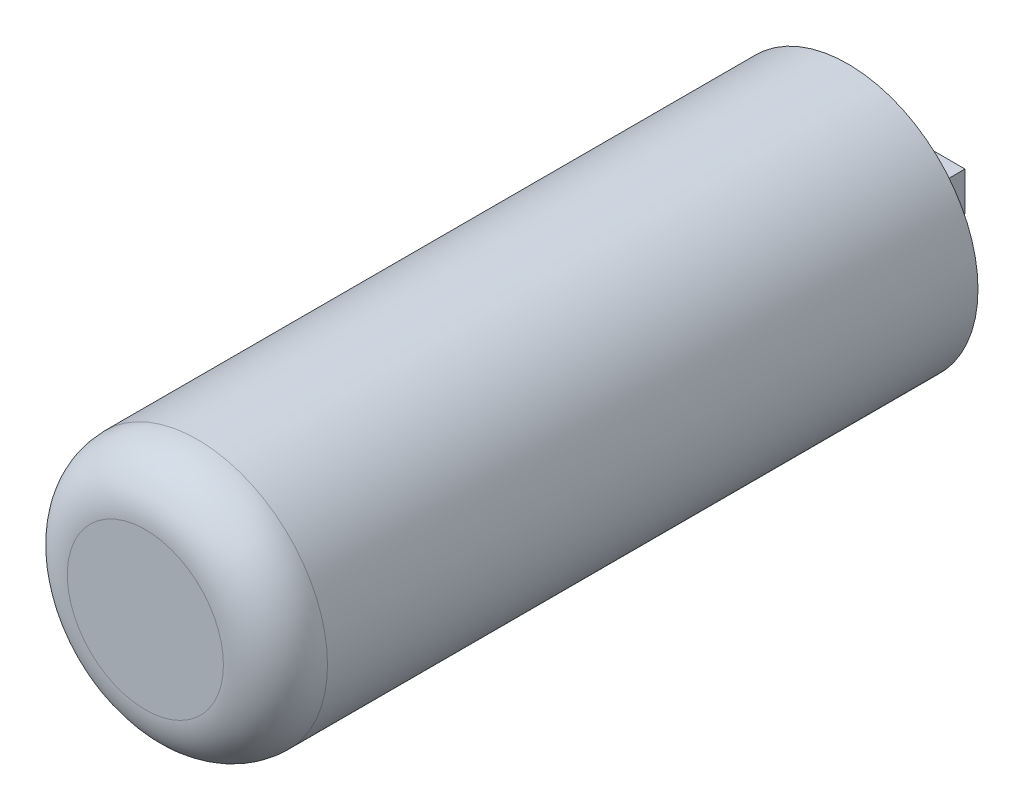
from build123d import *

# Parameters (mm, degrees)
SKETCH1_R           = 5
BOSS_EXTRUDE1_DEPTH = 27
FILLET1_R           = 2
SKETCH2_W           = 3
SKETCH2_H           = 1.5
BOSS_EXTRUDE2_DEPTH = 3
SKETCH3_R           = 0.75
CUT_EXTRUDE1_DEPTH  = 5


with BuildPart() as part:
    # Sketch1 → Boss-Extrude1 (new body)
    with BuildSketch(Plane.XY):
        Circle(SKETCH1_R)
    extrude(amount=BOSS_EXTRUDE1_DEPTH)

    # Fillet1
    fillet1_edges = [part.edges().sort_by_distance(p)[0] for p in [
        (-5, 0, 27),
    ]]
    fillet(fillet1_edges, radius=FILLET1_R)

    # Sketch2 → Boss-Extrude2 (add)
    with BuildSketch(Plane(origin=(0, 0, 0), x_dir=(-1, 0, 0), z_dir=(0, 0, -1))):
        Rectangle(SKETCH2_W, SKETCH2_H)
    extrude(amount=BOSS_EXTRUDE2_DEPTH)

    # Sketch3 → Cut-Extrude1 (cut)
    with BuildSketch(Plane(origin=(0, 0.75, 0), x_dir=(1, 0, 0), z_dir=(0, 1, 0))):
        with Locations(Location((0, 1.5, 0), (0, 0, 270))):
            Circle(SKETCH3_R)
    extrude(amount=-CUT_EXTRUDE1_DEPTH, mode=Mode.SUBTRACT)


solid = part.part
